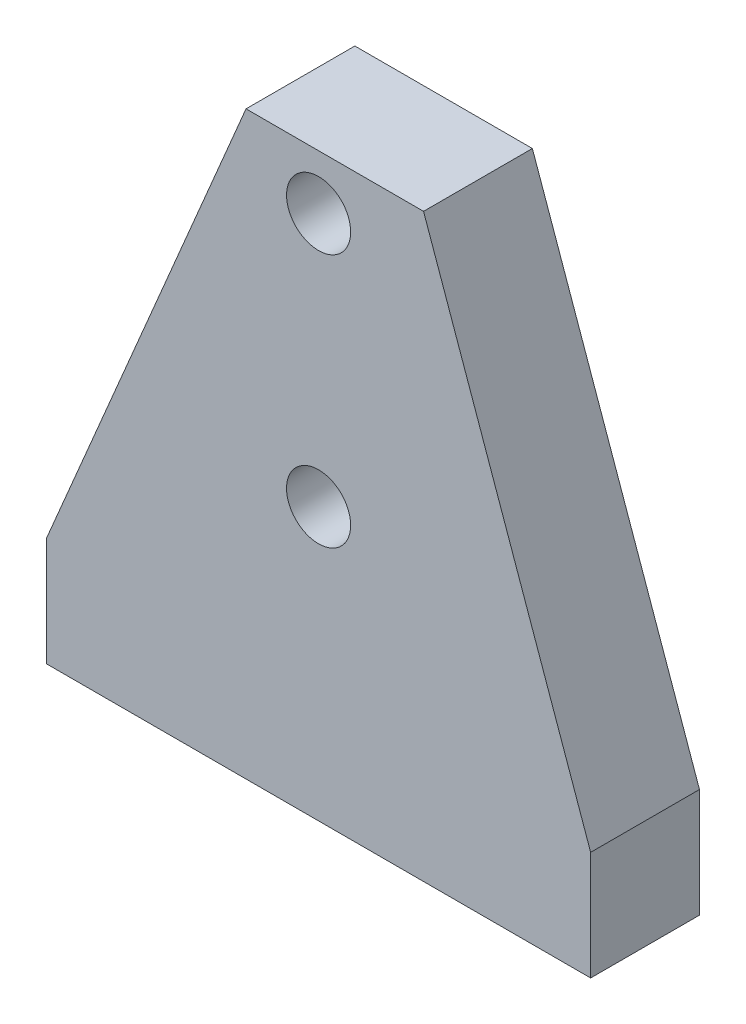
from build123d import *

# Parameters (mm, degrees)
BOSS_EXTRUDE1_DEPTH       = 9.525
F_10_CLEARANCE_HOLE1_D    = 5.6134
M6X1_0_TAPPED_HOLE1_D     = 5
M6X1_0_TAPPED_HOLE1_DEPTH = 13.0048


with BuildPart() as part:
    # Sketch1 → Boss-Extrude1 (new body)
    with BuildSketch(Plane.XY):
        Polygon((23.8125, -25.4), (23.8125, -15.875), (9.186500373, 25.4), (-6.35, 25.4), (-23.8125, -15.875), (-23.8125, -25.4), align=None)
    extrude(amount=BOSS_EXTRUDE1_DEPTH)

    # #10 Clearance Hole1 (through all)
    with Locations(Plane.XY.offset(9.525)):
        with Locations((0, 20.6375), (0, -1.5875)):
            Hole(F_10_CLEARANCE_HOLE1_D / 2)

    # M6x1.0 Tapped Hole1
    with Locations(Plane(origin=(0, -25.4, 0), x_dir=(-1, 0, 0), z_dir=(0, -1, 0))):
        with Locations((13.9954, -4.7625), (-13.9954, -4.7625)):
            Hole(M6X1_0_TAPPED_HOLE1_D / 2, depth=M6X1_0_TAPPED_HOLE1_DEPTH)


solid = part.part
